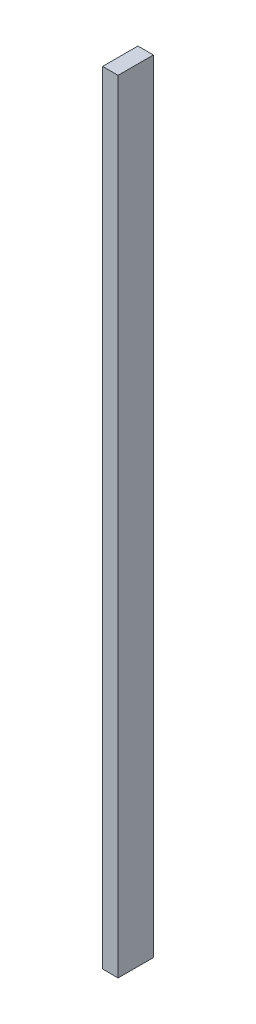
from build123d import *

# Parameters (mm, degrees)
SKETCH1_W           = 101.6
SKETCH1_H           = 231.775
BOSS_EXTRUDE1_DEPTH = 5130.8


with BuildPart() as part:
    # Sketch1 → Boss-Extrude1 (new body)
    with BuildSketch(Plane(origin=(0, 0, 0), x_dir=(1, 0, 0), z_dir=(0, 1, 0))):
        Rectangle(SKETCH1_W, SKETCH1_H)
    extrude(amount=BOSS_EXTRUDE1_DEPTH)


solid = part.part
